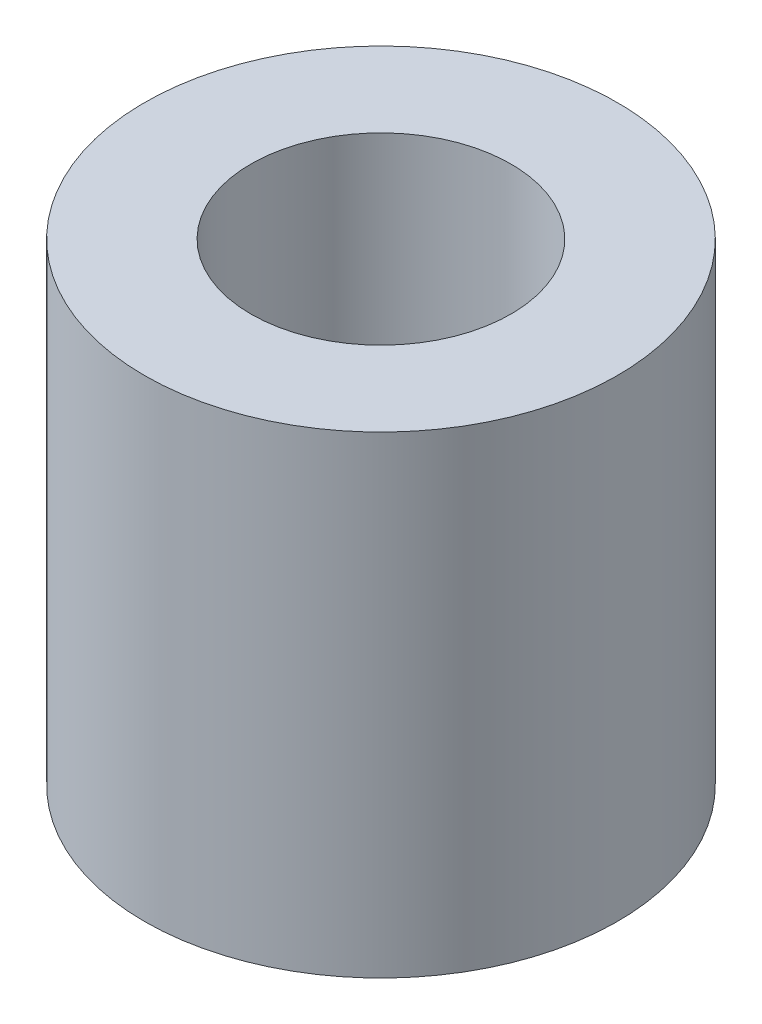
from build123d import *

# Parameters (mm, degrees)
SKETCH1_R             = 3
BOSS_EXTRUDE1_DEPTH   = 6
M4X0_7_TAPPED_HOLE1_D = 3.3


with BuildPart() as part:
    # Sketch1 → Boss-Extrude1 (new body)
    with BuildSketch(Plane(origin=(0, 0, 0), x_dir=(1, 0, 0), z_dir=(0, 1, 0))):
        with Locations(Location((0, 0, 0), (0, 0, 270))):
            Circle(SKETCH1_R)
    extrude(amount=BOSS_EXTRUDE1_DEPTH)

    # M4x0.7 Tapped Hole1 (through all)
    with Locations(Plane(origin=(0, 6, 0), x_dir=(1, 0, 0), z_dir=(0, 1, 0))):
        with Locations((0, 0)):
            Hole(M4X0_7_TAPPED_HOLE1_D / 2)


solid = part.part
